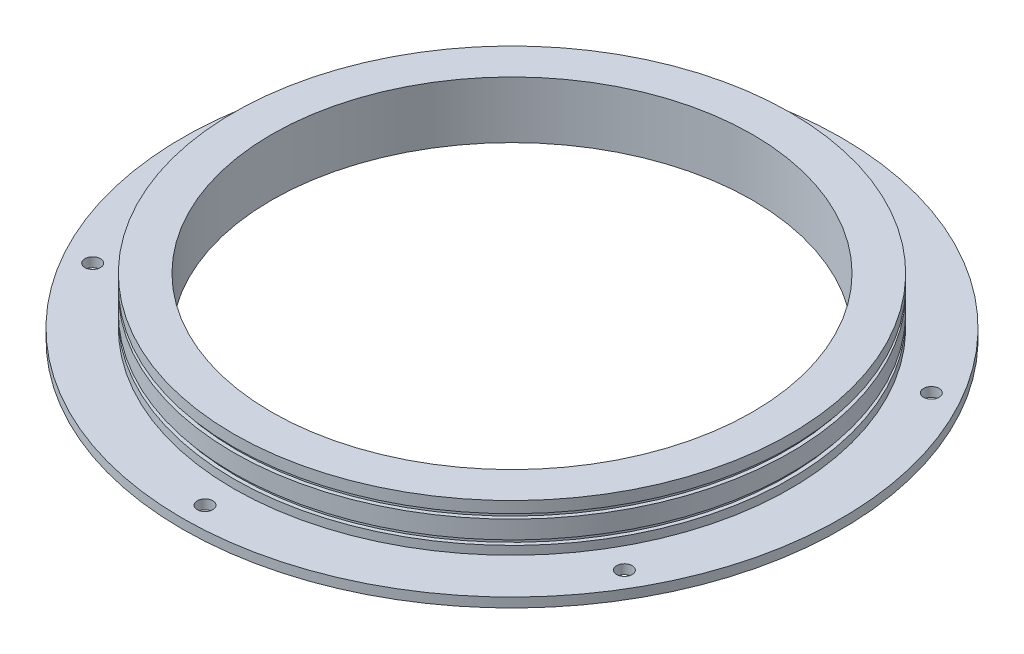
from build123d import *

# Parameters (mm, degrees)
SKETCH1_R           = 173.85
SKETCH1_R_2         = 4.1
SKETCH1_R_3         = 126.85
BOSS_EXTRUDE1_DEPTH = 5
SKETCH1_3_R         = 146.85
SKETCH1_3_R_2       = 126.85
BOSS_EXTRUDE2_DEPTH = 30
CUT_EXTRUDE1_START  = 9.5
SKETCH1_4_R         = 146.85
SKETCH1_4_R_2       = 144.85
CUT_EXTRUDE1_DEPTH  = 2.5
CUT_EXTRUDE2_START  = 21.5
SKETCH1_5_R         = 146.85
SKETCH1_5_R_2       = 144.85
CUT_EXTRUDE2_DEPTH  = 2.5


with BuildPart() as part:
    # Sketch1 → Boss-Extrude1 (new body)
    with BuildSketch(Plane(origin=(0, 0, 0), x_dir=(1, 0, 0), z_dir=(0, 1, 0))):
        Circle(SKETCH1_R)
        with Locations((-140.231163508, -80.9625)):
            Circle(SKETCH1_R_2, mode=Mode.SUBTRACT)
        with Locations((0, -161.925)):
            Circle(SKETCH1_R_2, mode=Mode.SUBTRACT)
        with Locations((140.231163508, -80.9625)):
            Circle(SKETCH1_R_2, mode=Mode.SUBTRACT)
        with Locations((-140.231163508, 80.9625)):
            Circle(SKETCH1_R_2, mode=Mode.SUBTRACT)
        with Locations((0, 161.925)):
            Circle(SKETCH1_R_2, mode=Mode.SUBTRACT)
        with Locations((140.231163508, 80.9625)):
            Circle(SKETCH1_R_2, mode=Mode.SUBTRACT)
        Circle(SKETCH1_R_3, mode=Mode.SUBTRACT)
    extrude(amount=BOSS_EXTRUDE1_DEPTH)

    # Sketch1<3> → Boss-Extrude2 (add)
    with BuildSketch(Plane(origin=(0, 0, 0), x_dir=(1, 0, 0), z_dir=(0, 1, 0))):
        Circle(SKETCH1_3_R)
        Circle(SKETCH1_3_R_2, mode=Mode.SUBTRACT)
    extrude(amount=BOSS_EXTRUDE2_DEPTH)

    # Sketch1<4> → Cut-Extrude1 (cut)
    with BuildSketch(Plane(origin=(0, 0, 0), x_dir=(1, 0, 0), z_dir=(0, 1, 0)).offset(CUT_EXTRUDE1_START)):
        Circle(SKETCH1_4_R)
        Circle(SKETCH1_4_R_2, mode=Mode.SUBTRACT)
    extrude(amount=CUT_EXTRUDE1_DEPTH, mode=Mode.SUBTRACT)

    # Sketch1<5> → Cut-Extrude2 (cut)
    with BuildSketch(Plane(origin=(0, 0, 0), x_dir=(1, 0, 0), z_dir=(0, 1, 0)).offset(CUT_EXTRUDE2_START)):
        Circle(SKETCH1_5_R)
        Circle(SKETCH1_5_R_2, mode=Mode.SUBTRACT)
    extrude(amount=CUT_EXTRUDE2_DEPTH, mode=Mode.SUBTRACT)


solid = part.part
